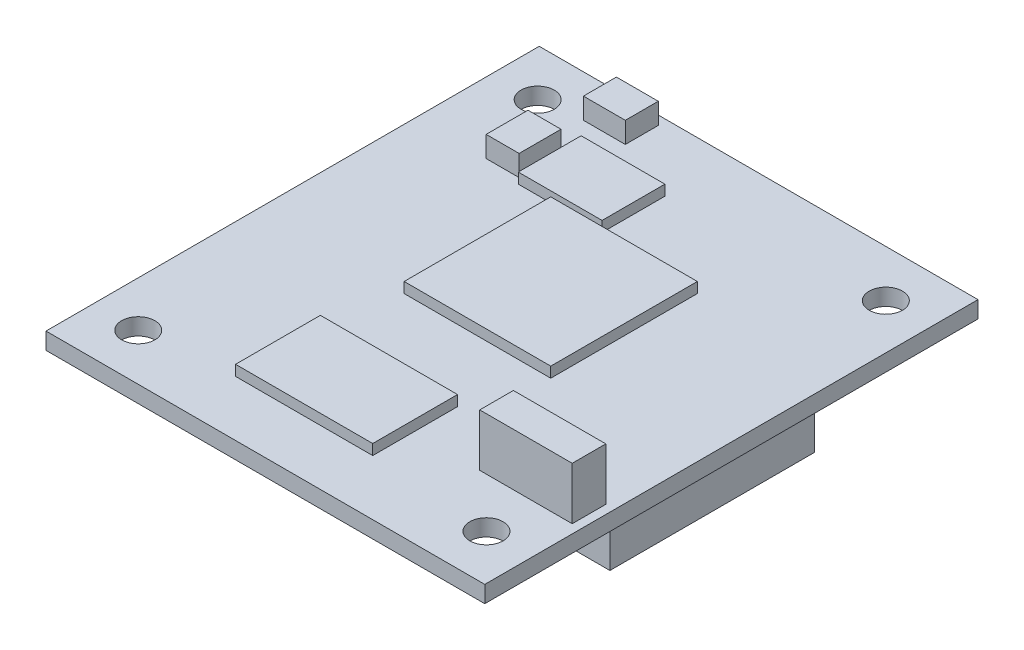
from build123d import *

# Parameters (mm, degrees)
SKETCH_1_W      = 41.9
SKETCH_1_H      = 47.1
SKETCH_1_R      = 1.5875
EXTRUDE_1_DEPTH = 1.6
SKETCH_2_W      = 3.15
SKETCH_2_H      = 4
SKETCH_2_W_2    = 4
SKETCH_2_H_2    = 3.15
EXTRUDE_2_DEPTH = 2
SKETCH_3_W      = 8.83
SKETCH_3_H      = 3.21
EXTRUDE_3_DEPTH = 5
SKETCH_4_W      = 4.77
SKETCH_4_H      = 19.56
EXTRUDE_4_DEPTH = 5
SKETCH_5_W      = 14
SKETCH_5_H      = 14
SKETCH_5_W_2    = 13.1
SKETCH_5_H_2    = 8.1
SKETCH_5_W_3    = 8
SKETCH_5_H_3    = 6
EXTRUDE_5_DEPTH = 1


with BuildPart() as part:
    # 草图1 → 凸台-拉伸1 (new body)
    with BuildSketch(Plane(origin=(0, 0, 0), x_dir=(1, 0, 0), z_dir=(0, 1, 0))):
        with Locations((20.95, 23.55)):
            Rectangle(SKETCH_1_W, SKETCH_1_H)
        with Locations(Location((4.34, 42.61, 0), (0, 0, 270))):
            Circle(SKETCH_1_R, mode=Mode.SUBTRACT)
        with Locations(Location((37.59, 42.61, 0), (0, 0, 270))):
            Circle(SKETCH_1_R, mode=Mode.SUBTRACT)
        with Locations(Location((37.59, 4.47, 0), (0, 0, 270))):
            Circle(SKETCH_1_R, mode=Mode.SUBTRACT)
        with Locations(Location((4.34, 4.47, 0), (0, 0, 270))):
            Circle(SKETCH_1_R, mode=Mode.SUBTRACT)
    extrude(amount=EXTRUDE_1_DEPTH)

    # 草图2 → 凸台-拉伸2 (add)
    with BuildSketch(Plane(origin=(0, 1.6, 0), x_dir=(1, 0, 0), z_dir=(0, 1, 0))):
        with Locations((8.325, 37.28)):
            Rectangle(SKETCH_2_W, SKETCH_2_H)
        with Locations((10.23, 44.665)):
            Rectangle(SKETCH_2_W_2, SKETCH_2_H_2)
    extrude(amount=EXTRUDE_2_DEPTH)

    # 草图3 → 凸台-拉伸3 (add)
    with BuildSketch(Plane(origin=(0, 1.6, 0), x_dir=(1, 0, 0), z_dir=(0, 1, 0))):
        with Locations((36.645, 10.795)):
            Rectangle(SKETCH_3_W, SKETCH_3_H)
    extrude(amount=EXTRUDE_3_DEPTH)

    # 草图4 → 凸台-拉伸4 (add)
    with BuildSketch(Plane.XZ):
        with Locations((4.155, -23.5)):
            Rectangle(SKETCH_4_W, SKETCH_4_H)
        with Locations((37.745, -23.5)):
            Rectangle(SKETCH_4_W, SKETCH_4_H)
    extrude(amount=EXTRUDE_4_DEPTH)

    # 草图5 → 凸台-拉伸5 (add)
    with BuildSketch(Plane(origin=(0, 1.6, 0), x_dir=(1, 0, 0), z_dir=(0, 1, 0))):
        with Locations((21, 27.2)):
            Rectangle(SKETCH_5_W, SKETCH_5_H)
        with Locations((19.35, 9.35)):
            Rectangle(SKETCH_5_W_2, SKETCH_5_H_2)
        with Locations((14.4, 37.7)):
            Rectangle(SKETCH_5_W_3, SKETCH_5_H_3)
    extrude(amount=EXTRUDE_5_DEPTH)


solid = part.part
